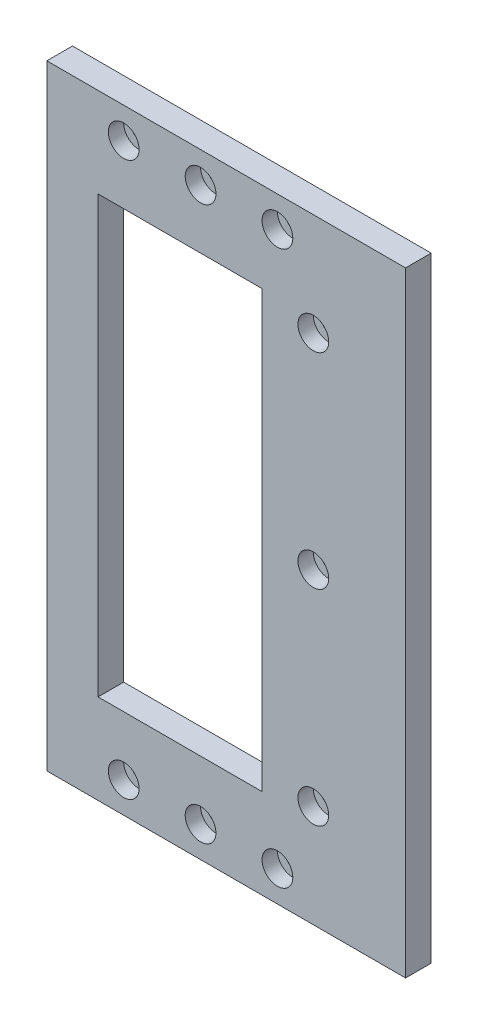
from build123d import *

# Parameters (mm, degrees)
EXTRUDE_1_DEPTH           = 5
HOLE_WIZARD_2_D           = 2.6
HOLE_WIZARD_2_DEPTH       = 10
HOLE_WIZARD_2_CBORE_D     = 6
HOLE_WIZARD_2_CBORE_DEPTH = 3
SKETCH_8_W                = 32
SKETCH_8_H                = 85
CUT_EXTRUDE_1_DEPTH       = 73.284161474


with BuildPart() as part:
    # 草圖3 → 填料-伸長1 (new body)
    with BuildSketch(Plane.XY):
        Polygon((-30, 60), (-30, -60), (0, -60), (40, -60), (40, 60), (0, 60), align=None)
    extrude(amount=EXTRUDE_1_DEPTH)

    # 鑽孔2
    with Locations(Plane(origin=(-15, 54, 5), x_dir=(1, 0, 0), z_dir=(0, 0, 1))):
        with Locations((0, 0), (15, 0), (30, 0), (37, -14), (37, -94), (30, -108), (15, -108), (0, -108), (37, -54)):
            CounterBoreHole(HOLE_WIZARD_2_D / 2, HOLE_WIZARD_2_CBORE_D / 2, HOLE_WIZARD_2_CBORE_DEPTH, depth=HOLE_WIZARD_2_DEPTH)

    # 草圖8 → 除料-伸長1 (cut, through all)
    with BuildSketch(Plane.XY.offset(5)):
        with Locations((-4, 0)):
            Rectangle(SKETCH_8_W, SKETCH_8_H)
    extrude(amount=-CUT_EXTRUDE_1_DEPTH, mode=Mode.SUBTRACT)


solid = part.part
